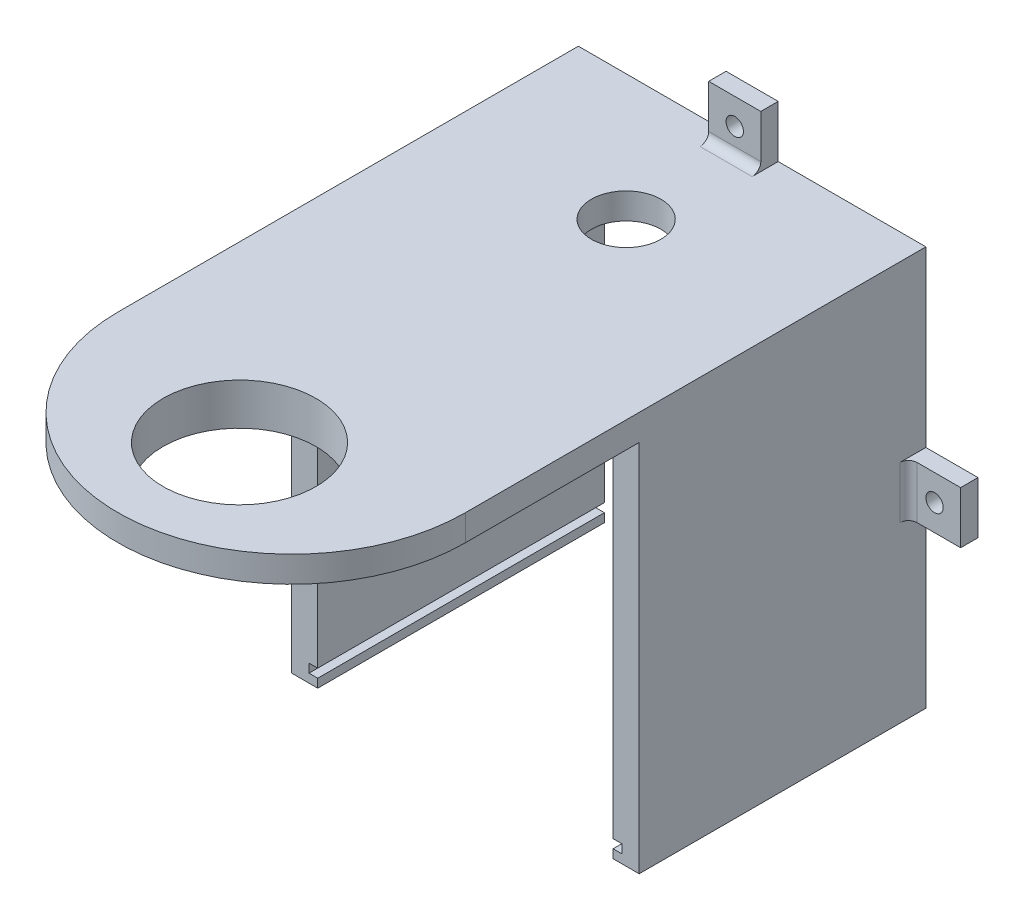
from build123d import *

# Parameters (mm, degrees)
SKETCH1_W           = 50.8
SKETCH1_H           = 58.42
SKETCH1_W_2         = 43.18
SKETCH1_H_2         = 50.8
EXTRUDE_THIN1_DEPTH = 41.91
SKETCH2_R           = 5.08
CUT_EXTRUDE1_DEPTH  = 5.08
SKETCH3_W           = 43.18
SKETCH3_H           = 41.91
CUT_EXTRUDE2_DEPTH  = 5.08
SKETCH4_W           = 7.62
SKETCH4_H           = 7.62
SKETCH4_R           = 1.27
BOSS_EXTRUDE1_DEPTH = 2.54
SKETCH5_W           = 41.91
SKETCH5_H           = 1.27
CUT_EXTRUDE3_DEPTH  = 1.27
SKETCH6_R           = 11.176
BOSS_EXTRUDE2_DEPTH = 3.81
FILLET2_R           = 1.27
SKETCH7_R           = 14.986
SKETCH7_R_2         = 11.176
BOSS_EXTRUDE3_DEPTH = 2.286


with BuildPart() as part:
    # Sketch1 → Extrude-Thin1 (new body)
    with BuildSketch(Plane.XY):
        Rectangle(SKETCH1_W, SKETCH1_H)
        Rectangle(SKETCH1_W_2, SKETCH1_H_2, mode=Mode.SUBTRACT)
    extrude(amount=EXTRUDE_THIN1_DEPTH)

    # Sketch2 → Cut-Extrude1 (cut)
    with BuildSketch(Plane(origin=(0, 29.21, 0), x_dir=(1, 0, 0), z_dir=(0, 1, 0))):
        with Locations(Location((0, -18.415, 0), (0, 0, 180))):
            Circle(SKETCH2_R)
    extrude(amount=-CUT_EXTRUDE1_DEPTH, mode=Mode.SUBTRACT)

    # Sketch3 → Cut-Extrude2 (cut)
    with BuildSketch(Plane.XZ.offset(29.21)):
        with Locations((0, 20.955)):
            Rectangle(SKETCH3_W, SKETCH3_H)
    extrude(amount=-CUT_EXTRUDE2_DEPTH, mode=Mode.SUBTRACT)

    # Sketch4 → Boss-Extrude1 (add)
    # profile 1 of 3: a face of its own
    with BuildSketch(Plane(origin=(0, 0, 0), x_dir=(-1, 0, 0), z_dir=(0, 0, -1))):
        with Locations((29.21, 0)):
            Rectangle(SKETCH4_W, SKETCH4_H)
        with Locations((29.21, 0)):
            Circle(SKETCH4_R, mode=Mode.SUBTRACT)
    # profile 2 of 3: a face of its own
    with BuildSketch(Plane(origin=(0, 0, 0), x_dir=(-1, 0, 0), z_dir=(0, 0, -1))):
        with Locations((-29.21, 0)):
            Rectangle(SKETCH4_W, SKETCH4_H)
        with Locations((-29.21, 0)):
            Circle(SKETCH4_R, mode=Mode.SUBTRACT)
    # profile 3 of 3: a face of its own
    with BuildSketch(Plane(origin=(0, 0, 0), x_dir=(-1, 0, 0), z_dir=(0, 0, -1))):
        with Locations((0, 33.02)):
            Rectangle(SKETCH4_W, SKETCH4_H)
        with Locations((0, 33.02)):
            Circle(SKETCH4_R, mode=Mode.SUBTRACT)
    extrude(amount=-BOSS_EXTRUDE1_DEPTH)

    # Sketch5 → Cut-Extrude3 (cut)
    with BuildSketch(Plane.ZY.offset(-21.59)):
        with Locations((20.955, -27.305)):
            Rectangle(SKETCH5_W, SKETCH5_H)
    cut_extrude3 = extrude(amount=-CUT_EXTRUDE3_DEPTH, mode=Mode.SUBTRACT)

    # Mirror1: Cut-Extrude3 across plane
    add(cut_extrude3.mirror(Plane.ZY), mode=Mode.SUBTRACT)

    # Sketch6 → Boss-Extrude2 (add)
    with BuildSketch(Plane(origin=(0, 29.21, 0), x_dir=(1, 0, 0), z_dir=(0, 1, 0))):
        with BuildLine():
            Line((25.4, -67.31), (25.4, -41.91))
            Line((25.4, -41.91), (-25.4, -41.91))
            Line((-25.4, -41.91), (-25.4, -67.31))
            ThreePointArc((-25.4, -67.31), (0, -92.71), (25.4, -67.31))
        make_face()
        with Locations(Location((0, -74.93, 0), (0, 0, 180))):
            Circle(SKETCH6_R, mode=Mode.SUBTRACT)
    extrude(amount=-BOSS_EXTRUDE2_DEPTH)

    # Fillet2
    fillet2_edges = [part.edges().sort_by_distance(p)[0] for p in [
        (-25.4, 0, 2.54),
        (25.4, 0, 2.54),
        (0, 29.21, 2.54),
    ]]
    fillet(fillet2_edges, radius=FILLET2_R)

    # Sketch7 → Boss-Extrude3 (add)
    with BuildSketch(Plane.XZ.offset(-25.4)):
        with Locations((0, 74.93)):
            Circle(SKETCH7_R)
        with Locations(Location((0, 74.93, 0), (0, 0, 180))):
            Circle(SKETCH7_R_2, mode=Mode.SUBTRACT)
    extrude(amount=BOSS_EXTRUDE3_DEPTH)


solid = part.part
